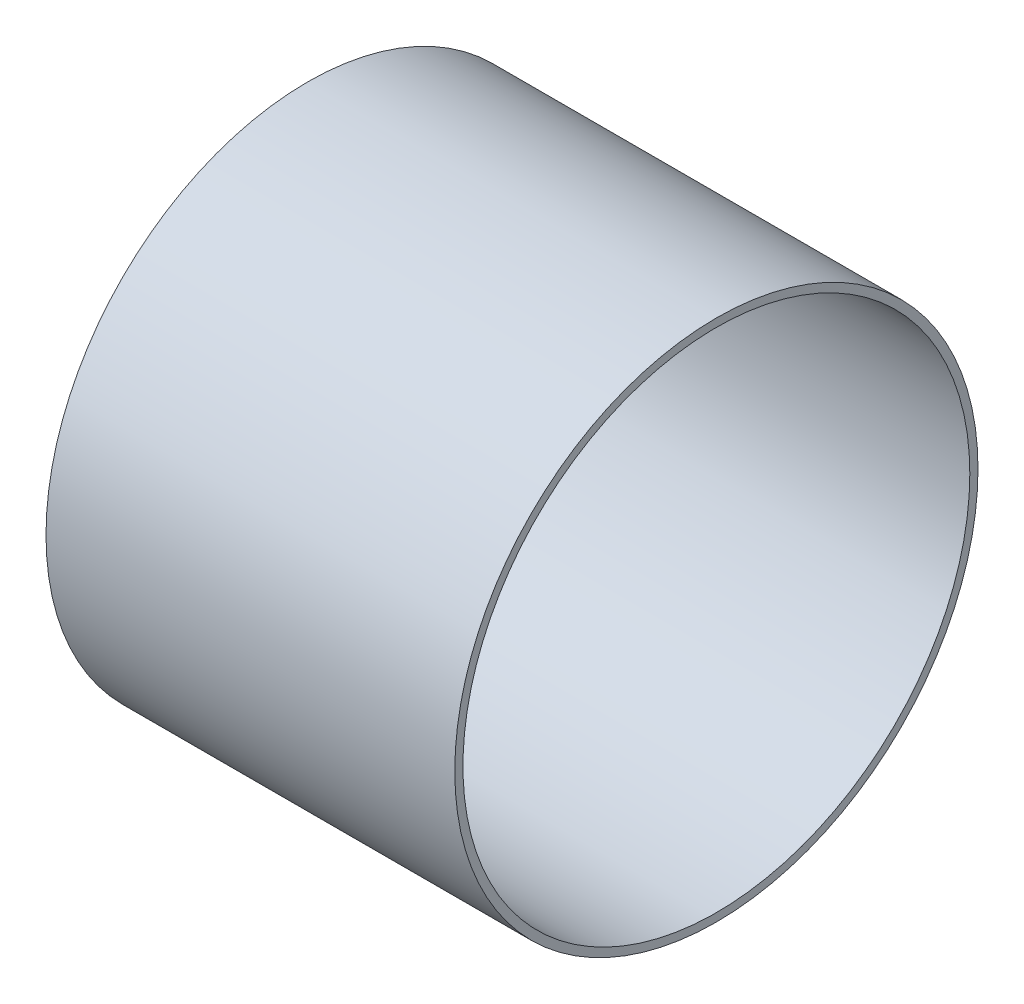
from build123d import *

# Parameters (mm, degrees)
SKETCH1_R           = 32.512
SKETCH1_R_2         = 31.496
BOSS_EXTRUDE1_DEPTH = 50.8


with BuildPart() as part:
    # Sketch1 → Boss-Extrude1 (new body)
    with BuildSketch(Plane(origin=(0, 0, 0), x_dir=(0, 0, -1), z_dir=(1, 0, 0))):
        Circle(SKETCH1_R)
        Circle(SKETCH1_R_2, mode=Mode.SUBTRACT)
    extrude(amount=BOSS_EXTRUDE1_DEPTH)


solid = part.part
